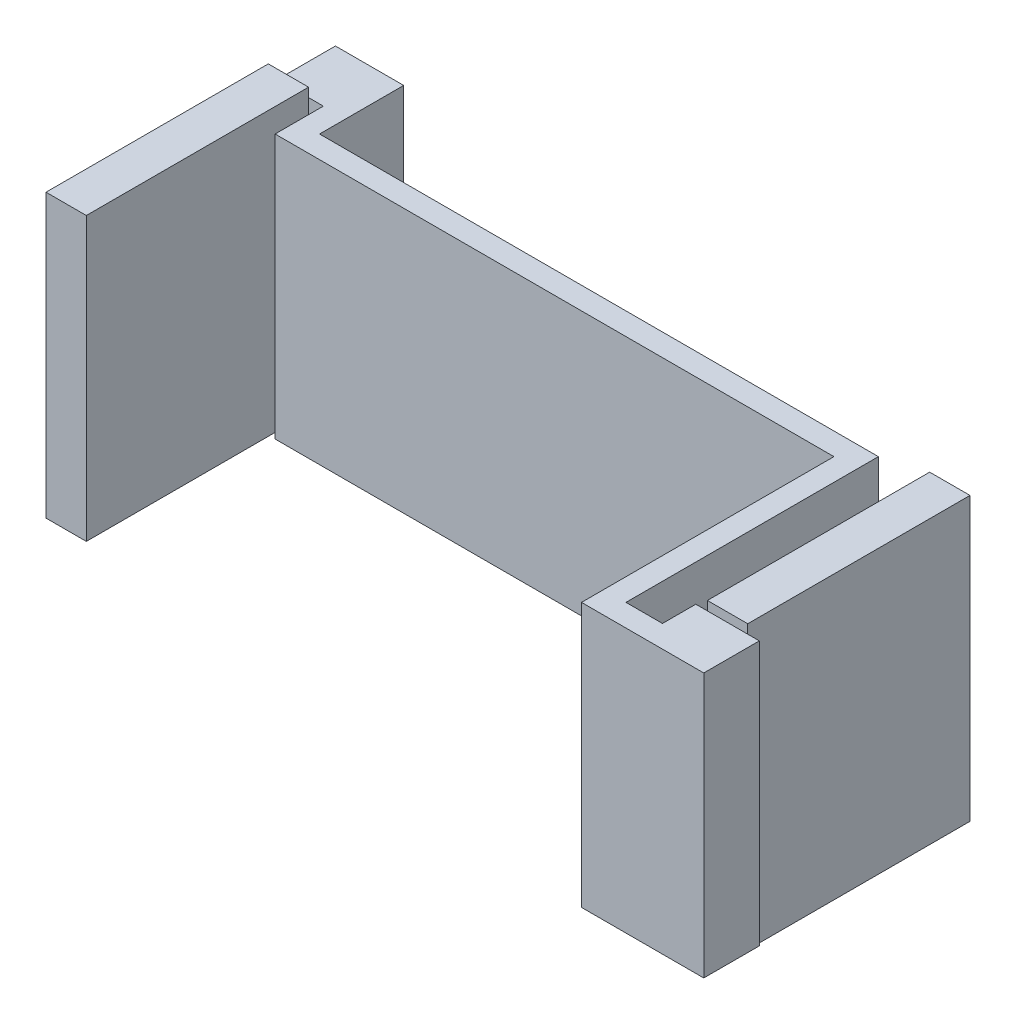
from build123d import *

# Parameters (mm, degrees)
MALE_START                                 = 10.1
SKETCH_1_W                                 = 2.54
SKETCH_1_H                                 = 17.78
MALE_HOUSINGS_IN_J5_DEPTH                  = 14
FEMALE_START                               = 8.66
SKETCH_2_W                                 = 2.54
SKETCH_2_H                                 = 17.78
FEMALE_HOUSINGS_ON_THE_MODULE_HEADER_DEPTH = 14
S_BEND_START                               = 5
SKETCH_3_W                                 = 4.3
SKETCH_3_H                                 = 16.64
S_BEND_ABOVE_THE_FEMALE_HOUSINGS_DEPTH     = 3.66
SKETCH_4_W                                 = 1.4
SKETCH_4_H                                 = 16.64
S_BEND_DOWN_LEG_DEPTH                      = 6.7
RUN_START                                  = 10.3
SKETCH_5_W                                 = 36.6
SKETCH_5_H                                 = 16.64
RUN_UNDER_THE_BATTERY_DEPTH                = 1.4
DROP_START                                 = 10.3
SKETCH_6_W                                 = 1.4
SKETCH_6_H                                 = 16.64
DROP_BESIDE_THE_MODULE_EDGE_DEPTH          = 17.3
RUN_START_2                                = 26.2
SKETCH_7_W                                 = 7.7
SKETCH_7_H                                 = 16.64
RUN_UNDER_THE_MALE_HOUSINGS_DEPTH          = 1.4
LOOP_START                                 = 24.1
SKETCH_8_W                                 = 4
SKETCH_8_H                                 = 16.64
LOOP_INTO_THE_MALE_HOUSINGS_DEPTH          = 3.5


with BuildPart() as part:
    # 草圖1 → male housings in J5 (new body)
    with BuildSketch(Plane.XY.offset(MALE_START)):
        with Locations((56, 45)):
            Rectangle(SKETCH_1_W, SKETCH_1_H)
    extrude(amount=MALE_HOUSINGS_IN_J5_DEPTH)



with BuildPart() as body_2:
    # 草圖2 → female housings on the module header (new body)
    with BuildSketch(Plane.XY.offset(FEMALE_START)):
        with Locations((12.9, 45)):
            Rectangle(SKETCH_2_W, SKETCH_2_H)
    extrude(amount=FEMALE_HOUSINGS_ON_THE_MODULE_HEADER_DEPTH)

    # 草圖3 → S-bend above the female housings (add)
    with BuildSketch(Plane.XY.offset(S_BEND_START)):
        with Locations((14.35, 45)):
            Rectangle(SKETCH_3_W, SKETCH_3_H)
    extrude(amount=S_BEND_ABOVE_THE_FEMALE_HOUSINGS_DEPTH)

    # 草圖4 → S-bend down leg (add)
    with BuildSketch(Plane.XY.offset(S_BEND_START)):
        with Locations((15.8, 45)):
            Rectangle(SKETCH_4_W, SKETCH_4_H)
    extrude(amount=S_BEND_DOWN_LEG_DEPTH)

    # 草圖5 → run under the battery (add)
    with BuildSketch(Plane.XY.offset(RUN_START)):
        with Locations((33.4, 45)):
            Rectangle(SKETCH_5_W, SKETCH_5_H)
    extrude(amount=RUN_UNDER_THE_BATTERY_DEPTH)

    # 草圖6 → drop beside the module edge (add)
    with BuildSketch(Plane.XY.offset(DROP_START)):
        with Locations((51, 45)):
            Rectangle(SKETCH_6_W, SKETCH_6_H)
    extrude(amount=DROP_BESIDE_THE_MODULE_EDGE_DEPTH)

    # 草圖7 → run under the male housings (add)
    with BuildSketch(Plane.XY.offset(RUN_START_2)):
        with Locations((54.15, 45)):
            Rectangle(SKETCH_7_W, SKETCH_7_H)
    extrude(amount=RUN_UNDER_THE_MALE_HOUSINGS_DEPTH)


with BuildPart() as part_1:
    add(part.part)

    add(body_2.part)  # loop into the male housings merges body 2
    # 草圖8 → loop into the male housings (add)
    with BuildSketch(Plane.XY.offset(LOOP_START)):
        with Locations((56, 45)):
            Rectangle(SKETCH_8_W, SKETCH_8_H)
    extrude(amount=LOOP_INTO_THE_MALE_HOUSINGS_DEPTH)


solid = part_1.part
